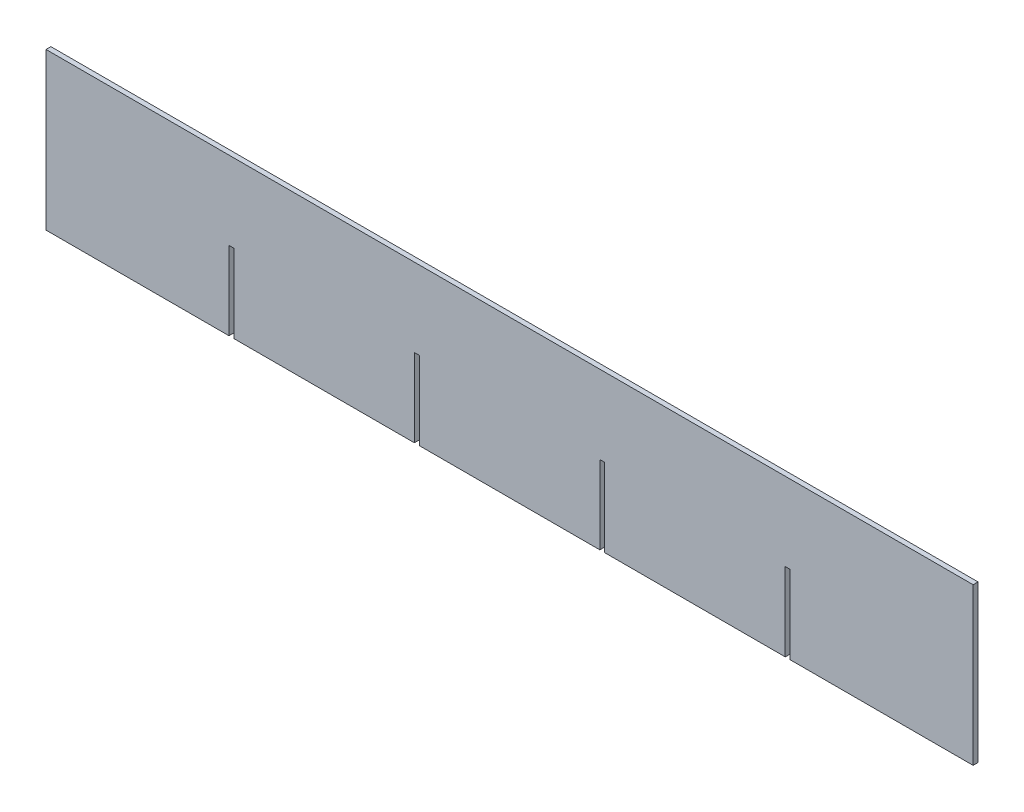
from build123d import *

# Parameters (mm, degrees)
BOSS_EXTRUDE1_DEPTH = 1.25


with BuildPart() as part:
    # Sketch1 → Boss-Extrude1 (new, symmetric)
    with BuildSketch(Plane.XY):
        Polygon((-48.65, -40), (-48.65, 0), (-46.15, 0), (-46.15, -40), (46.15, -40), (46.15, 0), (48.65, 0), (48.65, -40), (140.95, -40), (140.95, 0), (143.45, 0), (143.45, -40), (237, -40), (237, 40), (-237, 40), (-237, -40), (-143.45, -40), (-143.45, 0), (-140.95, 0), (-140.95, -40), align=None)
    extrude(amount=BOSS_EXTRUDE1_DEPTH, both=True)


solid = part.part
